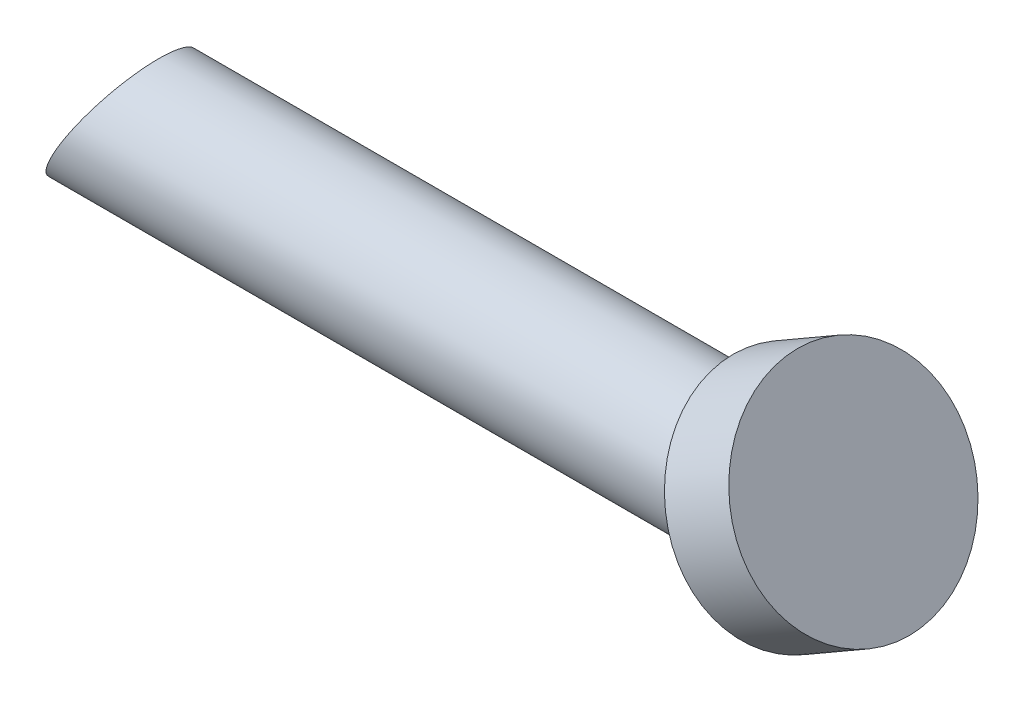
from build123d import *

# Parameters (mm, degrees)
SKETCH1_R               = 0.875
BOSS_EXTRUDE1_DEPTH     = 5
CUT_EXTRUDE1_DEPTH      = 6.150849445
CUT_EXTRUDE1_DEPTH_BACK = 6.150849445
SKETCH3_R               = 1.5
BOSS_EXTRUDE2_DEPTH     = 1


with BuildPart() as part:
    # Sketch1 → Boss-Extrude1 (new, symmetric)
    with BuildSketch(Plane(origin=(0, 0, 0), x_dir=(0, 0, -1), z_dir=(1, 0, 0))):
        Circle(SKETCH1_R)
    extrude(amount=BOSS_EXTRUDE1_DEPTH, both=True)

    # Sketch2 → Cut-Extrude1 (cut, two sides: drawn at the far end of the back side and taken through both)
    with BuildSketch(Plane.XY.offset(-CUT_EXTRUDE1_DEPTH_BACK)):
        Polygon((-5, 0.875), (-5, -0.875), (-3.989637029, 0.875), align=None)
        Polygon((5, 0.875), (3.989637029, 0.875), (5, -0.875), align=None)
    extrude(amount=CUT_EXTRUDE1_DEPTH + CUT_EXTRUDE1_DEPTH_BACK, mode=Mode.SUBTRACT)

    # Sketch3 → Boss-Extrude2 (add)
    with BuildSketch(Plane(origin=(3.371113886, 1.946313509, 0), x_dir=(0, 0, -1), z_dir=(0.866025403784438, 0.5000000000000012, 0))):
        with Locations(Location((0, -2.247409257, 0), (0, 0, 90))):
            Circle(SKETCH3_R)
    extrude(amount=BOSS_EXTRUDE2_DEPTH)


solid = part.part
